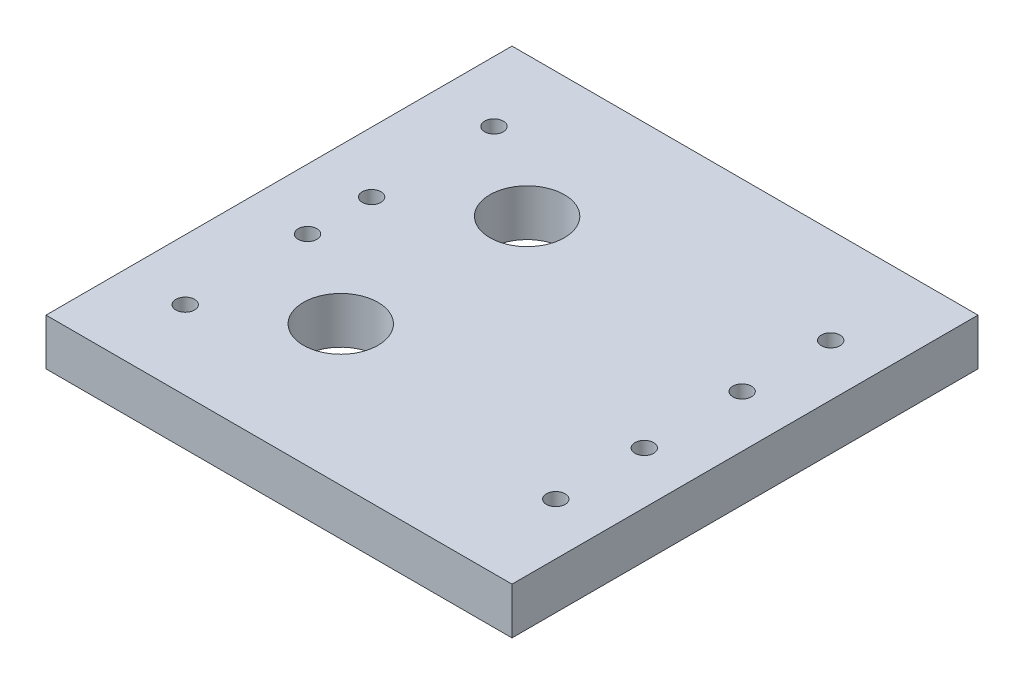
from build123d import *

# Parameters (mm, degrees)
SKETCH_1_W          = 200
SKETCH_1_H          = 200
EXTRUDE_1_DEPTH     = 20
SKETCH_2_R          = 16
SKETCH_2_R_2        = 4
CUT_EXTRUDE_1_DEPTH = 143.828568571


with BuildPart() as part:
    # 草图1 → 凸台-拉伸1 (new body)
    with BuildSketch(Plane(origin=(0, 0, 0), x_dir=(1, 0, 0), z_dir=(0, 1, 0))):
        Rectangle(SKETCH_1_W, SKETCH_1_H)
    extrude(amount=EXTRUDE_1_DEPTH)

    # 草图2 → 切除-拉伸1 (cut, through all)
    with BuildSketch(Plane(origin=(0, 20, 0), x_dir=(1, 0, 0), z_dir=(0, 1, 0))):
        with Locations(Location((-33.5, 40, 0), (0, 0, 270))):
            Circle(SKETCH_2_R)
        with Locations(Location((-74, 66.25, 0), (0, 0, 270))):
            Circle(SKETCH_2_R_2)
        with Locations(Location((-74, 13.75, 0), (0, 0, 270))):
            Circle(SKETCH_2_R_2)
        with Locations(Location((77.78, 59, 0), (0, 0, 270))):
            Circle(SKETCH_2_R_2)
        with Locations(Location((77.78, 21, 0), (0, 0, 270))):
            Circle(SKETCH_2_R_2)
        with Locations(Location((77.78, -21, 0), (0, 0, 90))):
            Circle(SKETCH_2_R_2)
        with Locations(Location((77.78, -59, 0), (0, 0, 90))):
            Circle(SKETCH_2_R_2)
        with Locations(Location((-74, -13.75, 0), (0, 0, 90))):
            Circle(SKETCH_2_R_2)
        with Locations(Location((-74, -66.25, 0), (0, 0, 90))):
            Circle(SKETCH_2_R_2)
        with Locations(Location((-33.5, -40, 0), (0, 0, 90))):
            Circle(SKETCH_2_R)
    extrude(amount=-CUT_EXTRUDE_1_DEPTH, mode=Mode.SUBTRACT)


solid = part.part
